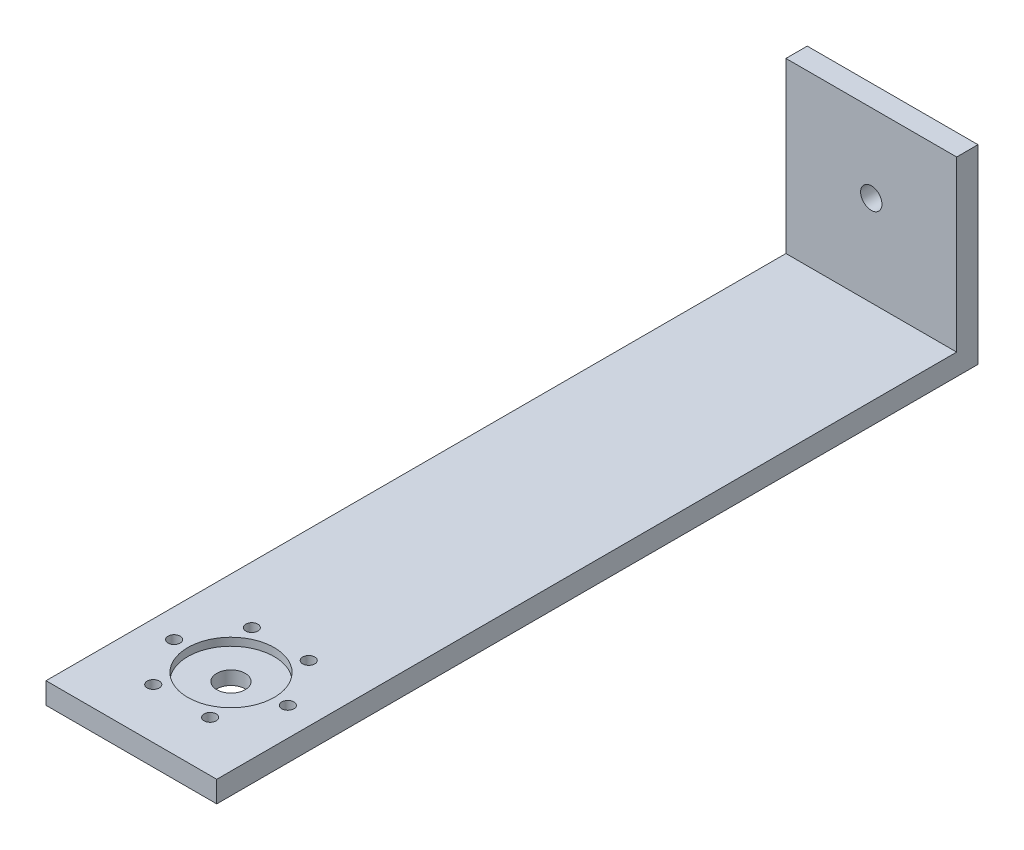
from build123d import *

# Parameters (mm, degrees)
SK_FOREARM_PLATE_W       = 48
SK_FOREARM_PLATE_H       = 208
SK_FOREARM_PLATE_R       = 1.7
SK_FOREARM_PLATE_R_2     = 4
FOREARM_PLATE_DEPTH      = 6
SK_ELBOW_PILOT_RECESS_R  = 12.15
ELBOW_PILOT_RECESS_DEPTH = 2.2
SK_HAND_PLATE_W          = 48
SK_HAND_PLATE_H          = 53.5
SK_HAND_PLATE_R          = 3
HAND_PLATE_DEPTH         = 6


with BuildPart() as part:
    # SK_Forearm_Plate → Forearm_Plate (new body)
    with BuildSketch(Plane(origin=(0, -31.5, 0), x_dir=(1, 0, 0), z_dir=(0, 1, 0))):
        with Locations((0, 76)):
            Rectangle(SK_FOREARM_PLATE_W, SK_FOREARM_PLATE_H)
        with Locations(Location((16, 0, 0), (0, 0, 270))):
            Circle(SK_FOREARM_PLATE_R, mode=Mode.SUBTRACT)
        with Locations(Location((8, 13.856406461, 0), (0, 0, 270))):
            Circle(SK_FOREARM_PLATE_R, mode=Mode.SUBTRACT)
        with Locations(Location((-8, 13.856406461, 0), (0, 0, 270))):
            Circle(SK_FOREARM_PLATE_R, mode=Mode.SUBTRACT)
        with Locations(Location((-16, 0, 0), (0, 0, 270))):
            Circle(SK_FOREARM_PLATE_R, mode=Mode.SUBTRACT)
        with Locations(Location((-8, -13.856406461, 0), (0, 0, 270))):
            Circle(SK_FOREARM_PLATE_R, mode=Mode.SUBTRACT)
        with Locations(Location((8, -13.856406461, 0), (0, 0, 270))):
            Circle(SK_FOREARM_PLATE_R, mode=Mode.SUBTRACT)
        with Locations(Location((0, 0, 0), (0, 0, 270))):
            Circle(SK_FOREARM_PLATE_R_2, mode=Mode.SUBTRACT)
    extrude(amount=FOREARM_PLATE_DEPTH)

    # SK_Elbow_Pilot_Recess → Elbow_Pilot_Recess (cut)
    with BuildSketch(Plane(origin=(0, -25.5, 0), x_dir=(1, 0, 0), z_dir=(0, 1, 0))):
        with Locations(Location((0, 0, 0), (0, 0, 270))):
            Circle(SK_ELBOW_PILOT_RECESS_R)
    extrude(amount=-ELBOW_PILOT_RECESS_DEPTH, mode=Mode.SUBTRACT)

    # SK_Hand_Plate → Hand_Plate (add)
    with BuildSketch(Plane.XY.offset(-186)):
        with Locations((0, -4.75)):
            Rectangle(SK_HAND_PLATE_W, SK_HAND_PLATE_H)
        Circle(SK_HAND_PLATE_R, mode=Mode.SUBTRACT)
    extrude(amount=HAND_PLATE_DEPTH)


solid = part.part
